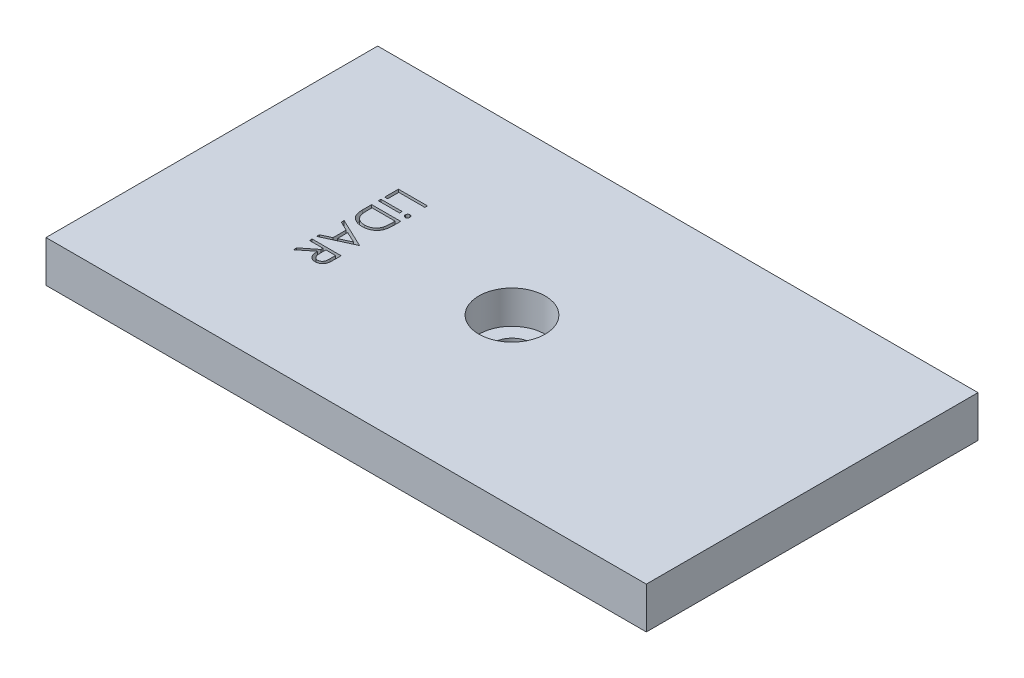
from build123d import *

# Parameters (mm, degrees)
SKETCH1_W                      = 72.4
SKETCH1_H                      = 40
BOSS_EXTRUDE1_DEPTH            = 6
CHAMFER1_SIZE                  = 1
CBORE_FOR_M4_SHCS1_D           = 4.5
CBORE_FOR_M4_SHCS1_CBORE_D     = 8
CBORE_FOR_M4_SHCS1_CBORE_DEPTH = 4
SKETCH4_W                      = 2.557692308
SKETCH4_H                      = 0.314102565
CUT_EXTRUDE1_DEPTH             = 1


with BuildPart() as part:
    # Sketch1 → Boss-Extrude1 (new body)
    with BuildSketch(Plane(origin=(0, 0, 0), x_dir=(1, 0, 0), z_dir=(0, 1, 0))):
        Rectangle(SKETCH1_W, SKETCH1_H)
    extrude(amount=BOSS_EXTRUDE1_DEPTH)

    # Chamfer1
    chamfer1_edges = [part.edges().sort_by_distance(p)[0] for p in [
        (0, 0, 20),
        (-36.2, 0, 0),
        (0, 0, -20),
        (36.2, 0, 0),
    ]]
    chamfer(chamfer1_edges, length=CHAMFER1_SIZE)

    # CBORE for M4 SHCS1 (through all)
    with Locations(Plane(origin=(0, 6, 0), x_dir=(1, 0, 0), z_dir=(0, 1, 0))):
        with Locations((0, 0)):
            CounterBoreHole(CBORE_FOR_M4_SHCS1_D / 2, CBORE_FOR_M4_SHCS1_CBORE_D / 2, CBORE_FOR_M4_SHCS1_CBORE_DEPTH)

    # Sketch4 → Cut-Extrude1 (cut)
    # profile 1 of 6: a face of its own
    with BuildSketch(Plane(origin=(0, 6, 0), x_dir=(1, 0, 0), z_dir=(0, 1, 0))):
        Polygon((-16.5, 6.304487179), (-16.5, 5.990384615), (-19.641025641, 5.990384615), (-19.641025641, 4.644230769), (-20, 4.644230769), (-20, 6.304487179), align=None)
    # profile 2 of 6: a face of its own
    with BuildSketch(Plane(origin=(0, 6, 0), x_dir=(1, 0, 0), z_dir=(0, 1, 0))):
        with BuildLine():
            add(Edge.make_bspline(
                [(-16.365384615, 4.039863782), (-16.36629269, 4.020375721), (-16.368070874, 3.982214354), (-16.383176643, 3.92697486), (-16.409172417, 3.876726064), (-16.442915564, 3.831491473), (-16.484230683, 3.793994076), (-16.53117379, 3.767106447), (-16.58227867, 3.749941466), (-16.617887461, 3.747856453), (-16.636017628, 3.746794872)],
                knots=[0, 0, 0, 0, 1.054986045, 2.065865298, 3.074122704, 4.105114675, 5.109626121, 6.074217918, 7.019490725, 8, 8, 8, 8], degree=3))
            add(Edge.make_bspline(
                [(-16.636017628, 3.746794872), (-16.653677192, 3.747880202), (-16.688588061, 3.75002577), (-16.738806847, 3.767093758), (-16.785096281, 3.794219497), (-16.826330626, 3.831466515), (-16.86005428, 3.876732655), (-16.886055203, 3.926973116), (-16.901159612, 3.982214812), (-16.902937984, 4.020375876), (-16.903846154, 4.039863782)],
                knots=[0, 0, 0, 0, 0.961106377, 1.899993565, 2.859409042, 3.870007927, 4.90724781, 5.921615355, 6.938620636, 8, 8, 8, 8], degree=3))
            add(Edge.make_bspline(
                [(-16.903846154, 4.039863782), (-16.902967151, 4.059127865), (-16.901256287, 4.096622886), (-16.885874492, 4.150846688), (-16.860110821, 4.200286964), (-16.825863936, 4.2447818), (-16.785370463, 4.282767293), (-16.738771881, 4.309792946), (-16.688596963, 4.326906568), (-16.653680183, 4.329045986), (-16.636017628, 4.330128205)],
                knots=[0, 0, 0, 0, 1.055304112, 2.054011575, 3.063363921, 4.096942562, 5.122536081, 6.088009498, 7.032825006, 8, 8, 8, 8], degree=3))
            add(Edge.make_bspline(
                [(-16.636017628, 4.330128205), (-16.617884357, 4.32906985), (-16.582269469, 4.326991175), (-16.531209353, 4.309779663), (-16.483954162, 4.282995494), (-16.443381916, 4.244757256), (-16.409116, 4.200293389), (-16.383357305, 4.150845015), (-16.36797421, 4.096623331), (-16.366263526, 4.059128016), (-16.365384615, 4.039863782)],
                knots=[0, 0, 0, 0, 0.986662878, 1.937868148, 2.908513651, 3.927890639, 4.955204348, 5.958438607, 6.951092507, 8, 8, 8, 8], degree=3))
        make_face()
    # profile 3 of 6: a face of its own
    with BuildSketch(Plane(origin=(0, 6, 0), x_dir=(1, 0, 0), z_dir=(0, 1, 0))):
        with Locations((-18.721153846, 4.038461539)):
            Rectangle(SKETCH4_W, SKETCH4_H)
    # profile 4 of 6: a face of its own
    with BuildSketch(Plane(origin=(0, 6, 0), x_dir=(1, 0, 0), z_dir=(0, 1, 0))):
        with BuildLine():
            Line((-20, 3.073717949), (-16.5, 3.073717949))
            Line((-16.5, 3.073717949), (-16.5, 2.366987179))
            add(Edge.make_bspline(
                [(-16.5, 2.366987179), (-16.500441364, 2.305518063), (-16.501294077, 2.186760051), (-16.506731622, 2.015149315), (-16.516253523, 1.856592024), (-16.530390835, 1.711178219), (-16.547359571, 1.578674282), (-16.568939567, 1.459292433), (-16.594319104, 1.352839205), (-16.615965573, 1.287369893), (-16.626201923, 1.256410256)],
                knots=[0, 0, 0, 0, 1.314317071, 2.539253741, 3.67075822, 4.709970291, 5.662644612, 6.526156501, 7.303037452, 8, 8, 8, 8], degree=3))
            add(Edge.make_bspline(
                [(-16.626201923, 1.256410256), (-16.641632646, 1.215915543), (-16.672144174, 1.135844401), (-16.729700224, 1.021836906), (-16.794914263, 0.914512932), (-16.867866673, 0.813288668), (-16.950643905, 0.720506945), (-17.039652514, 0.632427168), (-17.138529639, 0.553003306), (-17.243918105, 0.479048035), (-17.356887031, 0.414335964), (-17.475143662, 0.357267433), (-17.598466726, 0.308540873), (-17.727753834, 0.270520736), (-17.861763837, 0.239109628), (-18.001511188, 0.218033522), (-18.146181197, 0.204033518), (-18.244356924, 0.202633458), (-18.294170673, 0.201923077)],
                knots=[0, 0, 0, 0, 0.98467389, 1.947018643, 2.898343565, 3.837828625, 4.779009928, 5.722093987, 6.681368302, 7.658573986, 8.646467994, 9.637429229, 10.641859304, 11.657149908, 12.698561448, 13.768651538, 14.867827761, 16, 16, 16, 16], degree=3))
            add(Edge.make_bspline(
                [(-18.294170673, 0.201923077), (-18.337431765, 0.202552468), (-18.422682266, 0.20379275), (-18.548325256, 0.214915999), (-18.670231175, 0.231114488), (-18.787864626, 0.256078288), (-18.902018041, 0.286752778), (-19.012149321, 0.324614557), (-19.118339189, 0.369484432), (-19.219722654, 0.421542498), (-19.316131997, 0.478465682), (-19.405908182, 0.540878622), (-19.490758634, 0.605199855), (-19.566856155, 0.676388957), (-19.638553014, 0.749540211), (-19.701975299, 0.828532684), (-19.759885634, 0.910792849), (-19.811861317, 0.997905167), (-19.856955979, 1.091957586), (-19.895587774, 1.194233797), (-19.927397179, 1.305281562), (-19.95397895, 1.424930671), (-19.975053061, 1.553415572), (-19.989180388, 1.690854121), (-19.998733053, 1.83703753), (-19.999569484, 1.937416778), (-20, 1.989082532)],
                knots=[0, 0, 0, 0, 1.105818345, 2.179130549, 3.222742436, 4.24813173, 5.251184997, 6.243232575, 7.223185975, 8.195898781, 9.155064964, 10.083206407, 10.990357329, 11.874224667, 12.744762365, 13.607037788, 14.46074101, 15.315384698, 16.197310979, 17.123950979, 18.107232398, 19.148086642, 20.256146639, 21.433991621, 22.679261309, 24, 24, 24, 24], degree=3))
            Line((-20, 1.989082532), (-20, 3.073717949))
        make_face()
        with BuildLine():
            Line((-19.641025641, 2.759615385), (-19.641025641, 2.357872596))
            add(Edge.make_bspline(
                [(-19.641025641, 2.357872596), (-19.640777545, 2.300144225), (-19.640300364, 2.189111427), (-19.636113161, 2.02945343), (-19.629271224, 1.883574033), (-19.619696146, 1.751452524), (-19.607027531, 1.6331635), (-19.592902628, 1.52845975), (-19.575305177, 1.437684491), (-19.559354218, 1.382755054), (-19.551983173, 1.357371795)],
                knots=[0, 0, 0, 0, 1.375205317, 2.645023457, 3.804390687, 4.853969522, 5.800190428, 6.637939096, 7.370582563, 8, 8, 8, 8], degree=3))
            add(Edge.make_bspline(
                [(-19.551983173, 1.357371795), (-19.540732453, 1.325422757), (-19.518499737, 1.262287784), (-19.477929951, 1.171416467), (-19.429932617, 1.086623422), (-19.376265429, 1.006494005), (-19.316097236, 0.931547084), (-19.249245929, 0.86211514), (-19.176450828, 0.797704694), (-19.09743924, 0.739020336), (-19.012721991, 0.68658277), (-18.923377605, 0.640877622), (-18.829621713, 0.602097478), (-18.731116394, 0.570563618), (-18.627954501, 0.546126688), (-18.52040743, 0.528740101), (-18.40844163, 0.517931407), (-18.332289855, 0.516669123), (-18.293469551, 0.516025641)],
                knots=[0, 0, 0, 0, 0.998463025, 1.973077781, 2.929496817, 3.867873318, 4.813809365, 5.759268434, 6.706333209, 7.676553387, 8.657505312, 9.640584699, 10.632319813, 11.645628493, 12.686877747, 13.755137172, 14.855624085, 16, 16, 16, 16], degree=3))
            add(Edge.make_bspline(
                [(-18.293469551, 0.516025641), (-18.252536316, 0.516539475), (-18.172122613, 0.517548908), (-18.054128443, 0.530215463), (-17.940660382, 0.548765119), (-17.831636737, 0.575447354), (-17.72719935, 0.6099185), (-17.626758196, 0.65116602), (-17.531605855, 0.701246984), (-17.440936425, 0.757943931), (-17.356123035, 0.821596637), (-17.278159321, 0.891922741), (-17.206900054, 0.968180698), (-17.142231778, 1.050019059), (-17.08530453, 1.138582062), (-17.034662938, 1.232371046), (-16.99163483, 1.332707155), (-16.968757647, 1.402521165), (-16.95713141, 1.438000801)],
                knots=[0, 0, 0, 0, 1.122272916, 2.204715076, 3.251197285, 4.274229216, 5.279697671, 6.265416158, 7.248880903, 8.225321784, 9.195852973, 10.153576302, 11.101466393, 12.055578741, 13.010401466, 13.985536859, 14.976245305, 16, 16, 16, 16], degree=3))
            add(Edge.make_bspline(
                [(-16.95713141, 1.438000801), (-16.949014982, 1.467351948), (-16.93175723, 1.529760538), (-16.912931857, 1.631600002), (-16.896327358, 1.746215151), (-16.882269319, 1.874114853), (-16.872181998, 2.015153312), (-16.864610683, 2.169439), (-16.859504051, 2.337038604), (-16.859155343, 2.453221138), (-16.858974359, 2.513521635)],
                knots=[0, 0, 0, 0, 0.674548936, 1.434276114, 2.292660221, 3.240891867, 4.284742987, 5.42552168, 6.663806718, 8, 8, 8, 8], degree=3))
            Line((-16.858974359, 2.513521635), (-16.858974359, 2.759615385))
            Line((-16.858974359, 2.759615385), (-19.641025641, 2.759615385))
        make_face(mode=Mode.SUBTRACT)
    # profile 5 of 6: a face of its own
    with BuildSketch(Plane(origin=(0, 6, 0), x_dir=(1, 0, 0), z_dir=(0, 1, 0))):
        Polygon((-16.5, -1.951923077), (-20, -3.567307692), (-20, -3.225861378), (-18.878205128, -2.708433494), (-18.878205128, -1.121794872), (-20, -0.590344551), (-20, -0.246794872), (-16.5, -1.907051282), align=None)
        Polygon((-17.182892628, -1.925981571), (-18.519230769, -1.29286859), (-18.519230769, -2.54296875), align=None, mode=Mode.SUBTRACT)
    # profile 6 of 6: a face of its own
    with BuildSketch(Plane(origin=(0, 6, 0), x_dir=(1, 0, 0), z_dir=(0, 1, 0))):
        with BuildLine():
            Line((-16.5, -4.105769231), (-16.5, -4.806189904))
            add(Edge.make_bspline(
                [(-16.5, -4.806189904), (-16.500155586, -4.852931032), (-16.500454328, -4.942679177), (-16.502120091, -5.071252447), (-16.506894447, -5.188079544), (-16.51100303, -5.293099383), (-16.518494972, -5.386310038), (-16.525655619, -5.467997329), (-16.53502928, -5.537785027), (-16.543734703, -5.580030878), (-16.547676282, -5.599158654)],
                knots=[0, 0, 0, 0, 1.410062039, 2.707475311, 3.878576406, 4.937260626, 5.877586885, 6.699081471, 7.410979367, 8, 8, 8, 8], degree=3))
            add(Edge.make_bspline(
                [(-16.547676282, -5.599158654), (-16.55400233, -5.624765729), (-16.566519473, -5.675433611), (-16.592989487, -5.748377133), (-16.623570695, -5.817915599), (-16.659768254, -5.88378805), (-16.700950797, -5.946000596), (-16.747358942, -6.00446009), (-16.799229026, -6.058832302), (-16.855236506, -6.109535598), (-16.915870063, -6.155496505), (-16.980246433, -6.195269656), (-17.047962977, -6.229327206), (-17.11925551, -6.256516372), (-17.19352137, -6.278389222), (-17.27140904, -6.293816874), (-17.352570327, -6.303067671), (-17.407928192, -6.304009581), (-17.435997596, -6.304487179)],
                knots=[0, 0, 0, 0, 1.02737288, 2.032829108, 3.019628684, 3.985738875, 4.958353778, 5.924249254, 6.890702889, 7.883913451, 8.865824512, 9.85161466, 10.829249435, 11.81541824, 12.821369441, 13.843154991, 14.906364023, 16, 16, 16, 16], degree=3))
            add(Edge.make_bspline(
                [(-17.435997596, -6.304487179), (-17.482632754, -6.30301822), (-17.573630027, -6.300151898), (-17.705690159, -6.273426262), (-17.828882215, -6.22965169), (-17.943034754, -6.169321226), (-18.045982774, -6.092528302), (-18.136099546, -6.00024067), (-18.212207266, -5.892929636), (-18.264423869, -5.792561082), (-18.29802227, -5.703858698), (-18.321780902, -5.630619028), (-18.339827879, -5.550666264), (-18.356230059, -5.465147449), (-18.368746241, -5.373402029), (-18.377635108, -5.275614755), (-18.383350718, -5.171541056), (-18.384185793, -5.100201295), (-18.384615385, -5.063501603)],
                knots=[0, 0, 0, 0, 1.260402266, 2.459371274, 3.627181936, 4.786749125, 5.93865593, 7.087644312, 8.261344208, 9.485713728, 10.136162886, 10.825977872, 11.566646758, 12.35154167, 13.181268117, 14.0701832, 15.007234106, 16, 16, 16, 16], degree=3))
            Line((-18.384615385, -5.063501603), (-20, -6.349358974))
            Line((-20, -6.349358974), (-20, -5.9609375))
            Line((-20, -5.9609375), (-18.384615385, -4.675080128))
            Line((-18.384615385, -4.675080128), (-18.384615385, -4.419871795))
            Line((-18.384615385, -4.419871795), (-20, -4.419871795))
            Line((-20, -4.419871795), (-20, -4.105769231))
            Line((-20, -4.105769231), (-16.5, -4.105769231))
        make_face()
        with BuildLine():
            Line((-16.858974359, -4.419871795), (-18.025641026, -4.419871795))
            Line((-18.025641026, -4.419871795), (-18.030548878, -5.060697115))
            add(Edge.make_bspline(
                [(-18.030548878, -5.060697115), (-18.030562115, -5.090617154), (-18.030587771, -5.148610711), (-18.026593996, -5.232511378), (-18.022050673, -5.310631484), (-18.015101343, -5.382672255), (-18.006145223, -5.448665767), (-17.994942396, -5.508579385), (-17.98188982, -5.56250977), (-17.961690357, -5.625411121), (-17.929669718, -5.695628637), (-17.883161564, -5.77203468), (-17.824285939, -5.836879853), (-17.758032574, -5.892788961), (-17.683690187, -5.935853213), (-17.604558557, -5.967196434), (-17.521320853, -5.986866051), (-17.46414901, -5.989204491), (-17.435296474, -5.990384615)],
                knots=[0, 0, 0, 0, 1.14660753, 2.222451964, 3.218720504, 4.145691244, 4.995719623, 5.770487122, 6.480909919, 7.121111896, 8.299844659, 9.430703709, 10.534634535, 11.641396424, 12.741395289, 13.810956493, 14.895269934, 16, 16, 16, 16], degree=3))
            add(Edge.make_bspline(
                [(-17.435296474, -5.990384615), (-17.407142095, -5.989200863), (-17.351350389, -5.986855098), (-17.269896953, -5.967158323), (-17.192470091, -5.935350912), (-17.120545612, -5.89074956), (-17.05471362, -5.836855667), (-16.999164703, -5.772848655), (-16.952645723, -5.701951996), (-16.923135579, -5.635641774), (-16.905007029, -5.576413617), (-16.892265865, -5.524981511), (-16.881943017, -5.466646741), (-16.873917197, -5.401549109), (-16.866694876, -5.329806388), (-16.862012115, -5.251222133), (-16.859181853, -5.16588709), (-16.859045133, -5.106739908), (-16.858974359, -5.076121795)],
                knots=[0, 0, 0, 0, 1.100801541, 2.181386982, 3.260112282, 4.364594493, 5.481957178, 6.577424609, 7.668452592, 8.790448866, 9.403819393, 10.091598921, 10.863153553, 11.720938239, 12.658472417, 13.685008818, 14.801622349, 16, 16, 16, 16], degree=3))
            Line((-16.858974359, -5.076121795), (-16.858974359, -4.419871795))
        make_face(mode=Mode.SUBTRACT)
    extrude(amount=-CUT_EXTRUDE1_DEPTH, mode=Mode.SUBTRACT)


solid = part.part
